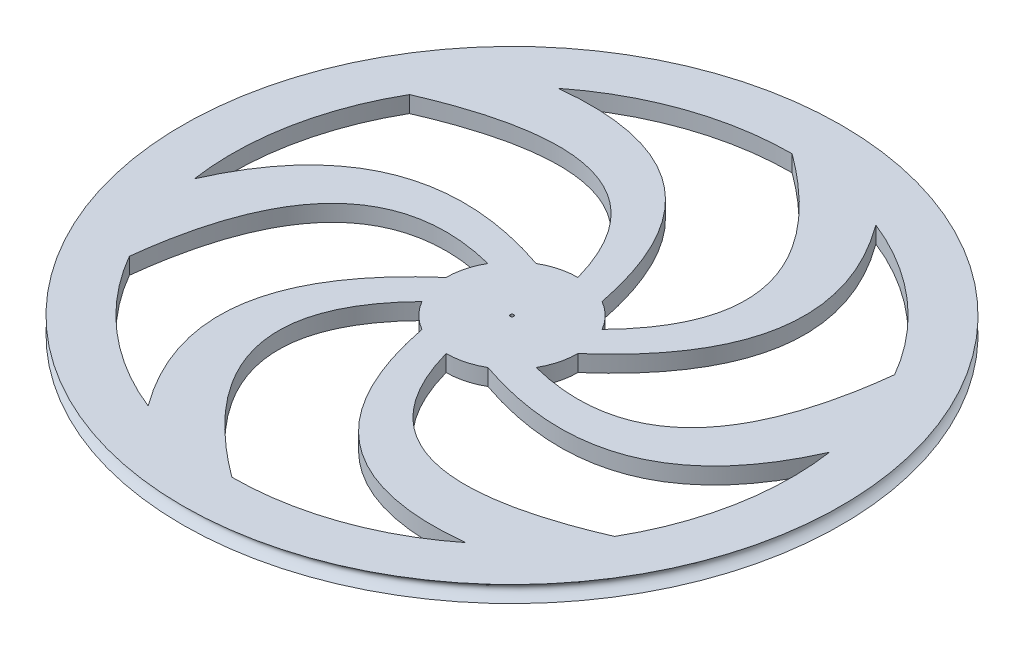
from build123d import *

# Parameters (mm, degrees)
SKETCH1_R           = 63.5
SKETCH1_R_2         = 0.3175
BOSS_EXTRUDE1_DEPTH = 3.175


with BuildPart() as part:
    # Sketch1 → Boss-Extrude1 (new body)
    with BuildSketch(Plane(origin=(0, 0, 0), x_dir=(1, 0, 0), z_dir=(0, 1, 0))):
        with Locations(Location((0, 0, 0), (0, 0, 270))):
            Circle(SKETCH1_R)
        with Locations(Location((0, 0, 0), (0, 0, 270))):
            Circle(SKETCH1_R_2, mode=Mode.SUBTRACT)
        with BuildLine():
            ThreePointArc((0, 12.7), (-3.287001873, 12.267257994), (-6.35, 10.998522628))
            add(Edge.make_bspline(
                [(-6.35, 10.998522628), (-40.0597869, 22.548298823), (-53.410384867, -7.786617578)],
                knots=[0, 0, 0, 1, 1, 1], degree=2))
            ThreePointArc((-53.410384867, -7.786617578), (-53.009631694, 10.162655788), (-46.743721169, 26.9875))
            add(Edge.make_bspline(
                [(0, 12.7), (-8.654197439, 43.517475509), (-46.743721169, 26.9875)],
                knots=[0, 0, 0, 1, 1, 1], degree=2))
        make_face(mode=Mode.SUBTRACT)
        with BuildLine():
            add(Edge.make_bspline(
                [(-10.998522628, 6.35), (-42.014338018, 14.263982923), (-46.743721169, -26.9875)],
                knots=[0, 0, 0, 1, 1, 1], degree=2))
            ThreePointArc((-10.998522628, 6.35), (-12.267257994, 3.287001873), (-12.7, 0))
            add(Edge.make_bspline(
                [(-12.7, 0), (-39.557293043, -23.418643714), (-19.961783802, -50.14805891)],
                knots=[0, 0, 0, 1, 1, 1], degree=2))
            ThreePointArc((-19.961783802, -50.14805891), (-35.305933929, -40.826359798), (-46.743721169, -26.9875))
        make_face(mode=Mode.SUBTRACT)
        with BuildLine():
            add(Edge.make_bspline(
                [(-10.998522628, -6.35), (-33.36014058, -29.253492586), (0, -53.975)],
                knots=[0, 0, 0, 1, 1, 1], degree=2))
            ThreePointArc((-10.998522628, -6.35), (-8.980256121, -8.980256121), (-6.35, -10.998522628))
            add(Edge.make_bspline(
                [(-6.35, -10.998522628), (0.502493857, -45.966942537), (33.448601066, -42.361441332)],
                knots=[0, 0, 0, 1, 1, 1], degree=2))
            ThreePointArc((33.448601066, -42.361441332), (17.703697765, -50.989015586), (0, -53.975))
        make_face(mode=Mode.SUBTRACT)
        with BuildLine():
            add(Edge.make_bspline(
                [(0, -12.7), (8.654197439, -43.517475509), (46.743721169, -26.9875)],
                knots=[0, 0, 0, 1, 1, 1], degree=2))
            ThreePointArc((0, -12.7), (3.287001873, -12.267257994), (6.35, -10.998522628))
            add(Edge.make_bspline(
                [(6.35, -10.998522628), (40.0597869, -22.548298823), (53.410384867, 7.786617578)],
                knots=[0, 0, 0, 1, 1, 1], degree=2))
            ThreePointArc((53.410384867, 7.786617578), (53.009631694, -10.162655788), (46.743721169, -26.9875))
        make_face(mode=Mode.SUBTRACT)
        with BuildLine():
            add(Edge.make_bspline(
                [(46.743721169, 26.9875), (42.014338018, -14.263982923), (10.998522628, -6.35)],
                knots=[0.554750304, 0.554750304, 0.554750304, 1.554750304, 1.554750304, 1.554750304], degree=2))
            ThreePointArc((10.998522628, -6.35), (12.267257994, -3.287001873), (12.7, 0))
            add(Edge.make_bspline(
                [(12.7, 0), (39.557293043, 23.418643714), (19.961783802, 50.14805891)],
                knots=[0, 0, 0, 1, 1, 1], degree=2))
            ThreePointArc((19.961783802, 50.14805891), (35.305933929, 40.826359798), (46.743721169, 26.9875))
        make_face(mode=Mode.SUBTRACT)
        with BuildLine():
            add(Edge.make_bspline(
                [(0, 53.975), (33.36014058, 29.253492586), (10.998522628, 6.35)],
                knots=[0.274970858, 0.274970858, 0.274970858, 1.274970858, 1.274970858, 1.274970858], degree=2))
            ThreePointArc((10.998522628, 6.35), (8.980256121, 8.980256121), (6.35, 10.998522628))
            add(Edge.make_bspline(
                [(6.35, 10.998522628), (-0.502493857, 45.966942537), (-33.448601066, 42.361441332)],
                knots=[0, 0, 0, 1, 1, 1], degree=2))
            ThreePointArc((-33.448601066, 42.361441332), (-17.703697765, 50.989015586), (0, 53.975))
        make_face(mode=Mode.SUBTRACT)
    extrude(amount=BOSS_EXTRUDE1_DEPTH)

    # Sketch2 → Cut-Revolve2 (revolve, cut)
    with BuildSketch(Plane.XY):
        with BuildLine():
            Line((-63.5, 0), (-63.5, 3.175))
            add(Edge.make_bspline(
                [(-63.5, 3.175), (-60.325, 1.5875), (-63.5, 0)],
                knots=[0, 0, 0, 1, 1, 1], degree=2))
        make_face()
    revolve(axis=Axis((0, 0, 0), (0, 1, 0)), mode=Mode.SUBTRACT)


solid = part.part
